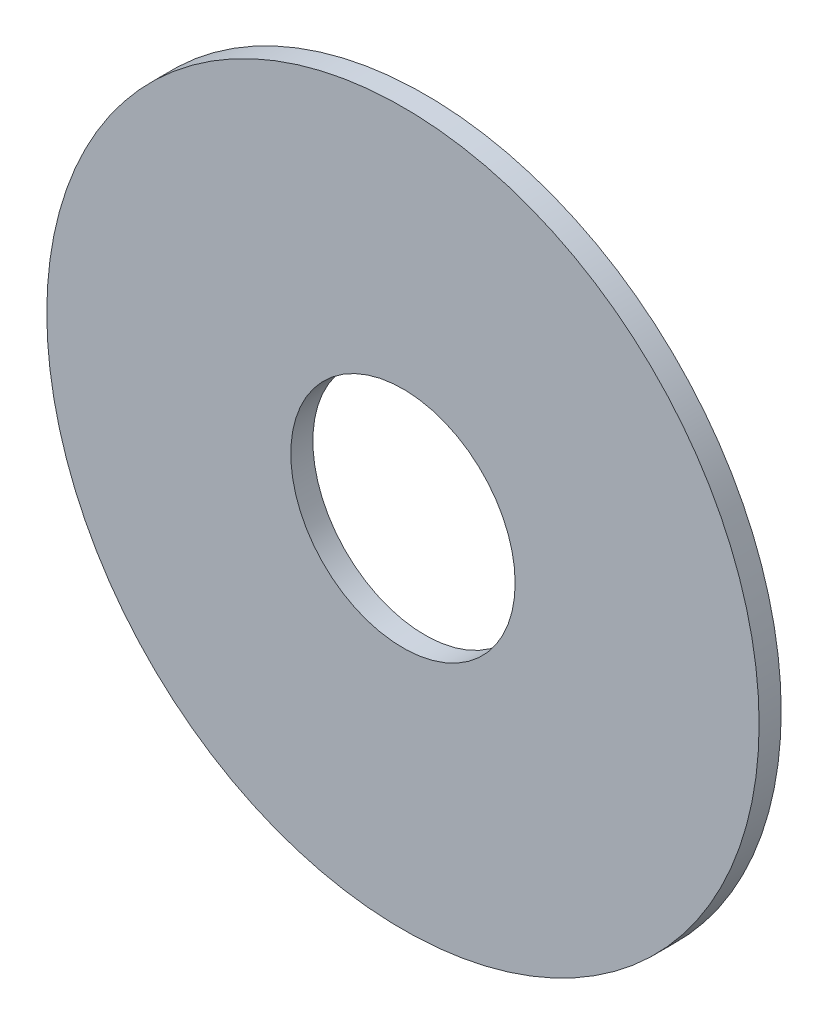
from build123d import *

# Parameters (mm, degrees)
SKETCH1_R      = 12.7
SKETCH1_R_2    = 4.0005
EXTRUDE1_DEPTH = 0.7874


with BuildPart() as part:
    # Sketch1 → Extrude1 (new body)
    with BuildSketch(Plane.XY):
        Circle(SKETCH1_R)
        Circle(SKETCH1_R_2, mode=Mode.SUBTRACT)
    extrude(amount=EXTRUDE1_DEPTH)


solid = part.part
